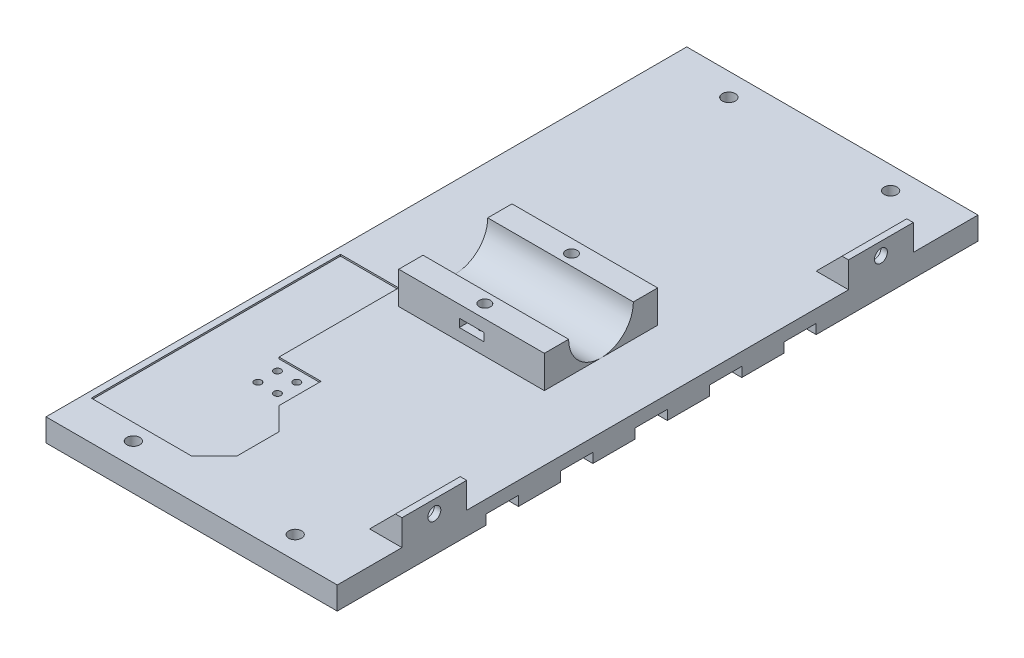
from build123d import *

# Parameters (mm, degrees)
BOSS_EXTRUDE1_DEPTH      = 4
SUPERFICIE_DEITADA_5_R   = 1.1
BOSS_EXTRUDE3_DEPTH      = 3.5
SKETCH13_W               = 45
SKETCH13_H               = 35
BOSS_EXTRUDE8_DEPTH      = 10
SKETCH14_R               = 10
CUT_EXTRUDE7_DEPTH       = 149.753536711
SKETCH15_W               = 7.6
SKETCH15_H               = 2.5
CUT_EXTRUDE8_DEPTH       = 7.6
SKETCH16_R               = 1.75
CUT_EXTRUDE9_DEPTH       = 10
SKETCH24_W               = 10
SKETCH24_H               = 20
BOSS_EXTRUDE12_DEPTH     = 8
CUT_EXTRUDE14_REACH      = 166.879
CUT_EXTRUDE15_START      = -8
SKETCH26_W               = 8
SKETCH26_H               = 14
CUT_EXTRUDE15_DEPTH      = 8
SKETCH27_R               = 2
CUT_EXTRUDE16_DEPTH      = 10
SKETCH29_W               = 90
SKETCH29_H               = 198
BOSS_EXTRUDE13_DEPTH     = 3
SKETCH28_R               = 2
CUT_EXTRUDE17_DEPTH      = 20
CUT_EXTRUDE18_DEPTH      = 60
SKETCH32_W               = 90
SKETCH32_H               = 10
CUT_EXTRUDE19_DEPTH      = 3
LPATTERN1_COUNT          = 5
LPATTERN1_PITCH          = 23
CUT_EXTRUDE20_DEPTH      = 141.861153921
CUT_EXTRUDE20_DEPTH_BACK = 141.861153921
SKETCH37_R               = 1.1


with BuildPart() as part:
    # Superficie_Deitada → Boss-Extrude1 (new body)
    with BuildSketch(Plane(origin=(0, 0, 0), x_dir=(1, 0, 0), z_dir=(0, 1, 0))):
        Polygon((-45, -123.066204139), (-45, -133.066204139), (45, -133.066204139), (45, 64.933795861), (-45, 64.933795861), (-45, -48.066204139), (-45, -83.066204139), align=None)
        Polygon((-25, -44.066204139), (-25, -73.763214607), (-25, -81.066204139), (-12, -81.066204139), (-12, -94.066204139), (-5, -101.066204139), (-5, -114.066204139), (-12, -121.066204139), (-43, -121.066204139), (-43, -44.066204139), (-26, -44.066204139), align=None, mode=Mode.SUBTRACT)
    extrude(amount=BOSS_EXTRUDE1_DEPTH)

    # Superficie_Deitada<5> → Boss-Extrude3 (add)
    # profile 1 of 3: a face of its own
    with BuildSketch(Plane(origin=(0, 0, 0), x_dir=(1, 0, 0), z_dir=(0, 1, 0))):
        Polygon((-25, -81.066204139), (-25, -73.763214607), (-25, -44.066204139), (-26, -44.066204139), (-43, -44.066204139), (-43, -121.066204139), (-12, -121.066204139), (-5, -114.066204139), (-5, -101.066204139), (-12, -94.066204139), (-12, -81.066204139), align=None)
        with Locations(Location((-22, -90.566204139, 0), (0, 0, 270))):
            Circle(SUPERFICIE_DEITADA_5_R, mode=Mode.SUBTRACT)
        with Locations(Location((-22, -84.566204139, 0), (0, 0, 270))):
            Circle(SUPERFICIE_DEITADA_5_R, mode=Mode.SUBTRACT)
        with Locations(Location((-16, -90.566204139, 0), (0, 0, 270))):
            Circle(SUPERFICIE_DEITADA_5_R, mode=Mode.SUBTRACT)
        with Locations(Location((-16, -84.566204139, 0), (0, 0, 270))):
            Circle(SUPERFICIE_DEITADA_5_R, mode=Mode.SUBTRACT)
    # profile 2 of 3: a face of its own
    with BuildSketch(Plane(origin=(0, 0, 0), x_dir=(1, 0, 0), z_dir=(0, 1, 0))):
        Polygon((-25, -81.066204139), (-25, -73.763214607), (-25, -44.066204139), (-26, -44.066204139), (-43, -44.066204139), (-43, -121.066204139), (-12, -121.066204139), (-5, -114.066204139), (-5, -101.066204139), (-12, -94.066204139), (-12, -81.066204139), align=None)
        with Locations(Location((-22, -90.566204139, 0), (0, 0, 270))):
            Circle(SUPERFICIE_DEITADA_5_R, mode=Mode.SUBTRACT)
        with Locations(Location((-22, -84.566204139, 0), (0, 0, 270))):
            Circle(SUPERFICIE_DEITADA_5_R, mode=Mode.SUBTRACT)
        with Locations(Location((-16, -90.566204139, 0), (0, 0, 270))):
            Circle(SUPERFICIE_DEITADA_5_R, mode=Mode.SUBTRACT)
        with Locations(Location((-16, -84.566204139, 0), (0, 0, 270))):
            Circle(SUPERFICIE_DEITADA_5_R, mode=Mode.SUBTRACT)
    # profile 3 of 3: a face of its own
    with BuildSketch(Plane(origin=(0, 0, 0), x_dir=(1, 0, 0), z_dir=(0, 1, 0))):
        Polygon((-25, -81.066204139), (-25, -73.763214607), (-25, -44.066204139), (-26, -44.066204139), (-43, -44.066204139), (-43, -121.066204139), (-12, -121.066204139), (-5, -114.066204139), (-5, -101.066204139), (-12, -94.066204139), (-12, -81.066204139), align=None)
        with Locations(Location((-22, -90.566204139, 0), (0, 0, 270))):
            Circle(SUPERFICIE_DEITADA_5_R, mode=Mode.SUBTRACT)
        with Locations(Location((-22, -84.566204139, 0), (0, 0, 270))):
            Circle(SUPERFICIE_DEITADA_5_R, mode=Mode.SUBTRACT)
        with Locations(Location((-16, -90.566204139, 0), (0, 0, 270))):
            Circle(SUPERFICIE_DEITADA_5_R, mode=Mode.SUBTRACT)
        with Locations(Location((-16, -84.566204139, 0), (0, 0, 270))):
            Circle(SUPERFICIE_DEITADA_5_R, mode=Mode.SUBTRACT)
    extrude(amount=BOSS_EXTRUDE3_DEPTH)

    # Sketch13 → Boss-Extrude8 (add)
    with BuildSketch(Plane(origin=(0, 4, 0), x_dir=(1, 0, 0), z_dir=(0, 1, 0))):
        with Locations((2.5, -31.566204139)):
            Rectangle(SKETCH13_W, SKETCH13_H)
    extrude(amount=BOSS_EXTRUDE8_DEPTH)

    # Sketch14 → Cut-Extrude7 (cut, through all)
    with BuildSketch(Plane.ZY.offset(20)):
        with Locations((31.566204139, 14)):
            Circle(SKETCH14_R)
    extrude(amount=-CUT_EXTRUDE7_DEPTH, mode=Mode.SUBTRACT)

    # Sketch15 → Cut-Extrude8 (cut)
    with BuildSketch(Plane.XY.offset(49.066204139)):
        with Locations((2.5, 9)):
            Rectangle(SKETCH15_W, SKETCH15_H)
    cut_extrude8 = extrude(amount=-CUT_EXTRUDE8_DEPTH, mode=Mode.SUBTRACT)

    # Sketch16 → Cut-Extrude9 (cut)
    with BuildSketch(Plane(origin=(0, 14, 0), x_dir=(1, 0, 0), z_dir=(0, 1, 0))):
        with Locations(Location((2.5, -44.966204139, 0), (0, 0, 270))):
            Circle(SKETCH16_R)
    cut_extrude9 = extrude(amount=-CUT_EXTRUDE9_DEPTH, mode=Mode.SUBTRACT)

    # Mirror1: Cut-Extrude8, Cut-Extrude9 across plane
    add(cut_extrude8.mirror(Plane(origin=(0, 0, 31.566204139), x_dir=(1, 0, 0), z_dir=(0, 0, -1))), mode=Mode.SUBTRACT)
    add(cut_extrude9.mirror(Plane(origin=(0, 0, 31.566204139), x_dir=(1, 0, 0), z_dir=(0, 0, -1))), mode=Mode.SUBTRACT)

    # Sketch24 → Boss-Extrude12 (add)
    with BuildSketch(Plane(origin=(0, 4, 0), x_dir=(1, 0, 0), z_dir=(0, 1, 0))):
        with Locations((40, 34.933795861)):
            Rectangle(SKETCH24_W, SKETCH24_H)
    boss_extrude12 = extrude(amount=BOSS_EXTRUDE12_DEPTH)

    # Sketch25 → Cut-Extrude14 (cut, up to next)
    with BuildSketch(Plane.XY.offset(-24.933795861), mode=Mode.PRIVATE) as cut_extrude14_sk1:
        Polygon((35, 4), (43, 12), (35, 12), align=None)
    cut_extrude14_tool1 = extrude(cut_extrude14_sk1.sketch, amount=-CUT_EXTRUDE14_REACH, mode=Mode.PRIVATE) & part.part
    cut_extrude14 = cut_extrude14_tool1.solids().sort_by_distance((37.666667, 9.333333, -24.933796))[0]
    add(cut_extrude14, mode=Mode.SUBTRACT)

    # Sketch26 → Cut-Extrude15 (cut)
    with BuildSketch(Plane(origin=(0, 12, 0), x_dir=(1, 0, 0), z_dir=(0, 1, 0)).offset(CUT_EXTRUDE15_START)):
        with Locations((39, 34.933795861)):
            Rectangle(SKETCH26_W, SKETCH26_H)
    cut_extrude15 = extrude(amount=CUT_EXTRUDE15_DEPTH, mode=Mode.SUBTRACT)

    # Sketch27 → Cut-Extrude16 (cut)
    with BuildSketch(Plane.ZY.offset(-43)):
        with Locations((-34.933795861, 8.08466157)):
            Circle(SKETCH27_R)
    cut_extrude16 = extrude(amount=-CUT_EXTRUDE16_DEPTH, mode=Mode.SUBTRACT)

    # Mirror7: Boss-Extrude12, Cut-Extrude14, Cut-Extrude15, Cut-Extrude16 across plane
    add(boss_extrude12.mirror(Plane(origin=(0, 0, 34.066204139), x_dir=(1, 0, 0), z_dir=(0, 0, -1))))
    add(cut_extrude14.mirror(Plane(origin=(0, 0, 34.066204139), x_dir=(1, 0, 0), z_dir=(0, 0, -1))), mode=Mode.SUBTRACT)
    add(cut_extrude15.mirror(Plane(origin=(0, 0, 34.066204139), x_dir=(1, 0, 0), z_dir=(0, 0, -1))), mode=Mode.SUBTRACT)
    add(cut_extrude16.mirror(Plane(origin=(0, 0, 34.066204139), x_dir=(1, 0, 0), z_dir=(0, 0, -1))), mode=Mode.SUBTRACT)

    # Sketch29 → Boss-Extrude13 (add)
    with BuildSketch(Plane.XZ):
        with Locations((0, 34.066204139)):
            Rectangle(SKETCH29_W, SKETCH29_H)
    extrude(amount=BOSS_EXTRUDE13_DEPTH)

    # Sketch28 → Cut-Extrude17 (cut)
    with BuildSketch(Plane(origin=(0, 4, 0), x_dir=(1, 0, 0), z_dir=(0, 1, 0))):
        with Locations(Location((25, 57.933795861, 0), (0, 0, 270))):
            Circle(SKETCH28_R)
        with Locations(Location((-25, 57.933795861, 0), (0, 0, 270))):
            Circle(SKETCH28_R)
        with Locations(Location((25, -126.066204139, 0), (0, 0, 270))):
            Circle(SKETCH28_R)
        with Locations(Location((-25, -126.066204139, 0), (0, 0, 270))):
            Circle(SKETCH28_R)
    extrude(amount=-CUT_EXTRUDE17_DEPTH, mode=Mode.SUBTRACT)

    # Sketch30 → Cut-Extrude18 (cut)
    with BuildSketch(Plane.ZY.offset(45)):
        Polygon((-44.933795861, -3), (-49.933795861, 2), (-24.933795861, 2), (-29.933795861, -3), align=None)
    cut_extrude18 = extrude(amount=-CUT_EXTRUDE18_DEPTH, mode=Mode.SUBTRACT)

    # Mirror8: Cut-Extrude18 across plane
    add(cut_extrude18.mirror(Plane(origin=(0, 0, 34.066204139), x_dir=(1, 0, 0), z_dir=(0, 0, -1))), mode=Mode.SUBTRACT)

    # Sketch32 → Cut-Extrude19 (cut)
    with BuildSketch(Plane.XZ.offset(3)):
        with Locations((0, -9.933795861)):
            Rectangle(SKETCH32_W, SKETCH32_H)
    cut_extrude19 = extrude(amount=-CUT_EXTRUDE19_DEPTH, mode=Mode.SUBTRACT)

    # LPattern1: Cut-Extrude19 ×5
    with Locations(*[(0, 0, i * LPATTERN1_PITCH) for i in range(1, LPATTERN1_COUNT)]):
        add(cut_extrude19, mode=Mode.SUBTRACT)

    # Sketch37 → Cut-Extrude20 (cut, two sides: drawn at the far end of the back side and taken through both)
    with BuildSketch(Plane(origin=(0, 3.5, 0), x_dir=(1, 0, 0), z_dir=(0, 1, 0)).offset(-CUT_EXTRUDE20_DEPTH_BACK)):
        with Locations(Location((-22, -84.566204139, 0), (0, 0, 270))):
            Circle(SKETCH37_R)
        with Locations(Location((-16, -84.566204139, 0), (0, 0, 270))):
            Circle(SKETCH37_R)
        with Locations(Location((-22, -90.566204139, 0), (0, 0, 270))):
            Circle(SKETCH37_R)
        with Locations(Location((-16, -90.566204139, 0), (0, 0, 270))):
            Circle(SKETCH37_R)
    extrude(amount=CUT_EXTRUDE20_DEPTH + CUT_EXTRUDE20_DEPTH_BACK, mode=Mode.SUBTRACT)


solid = part.part
